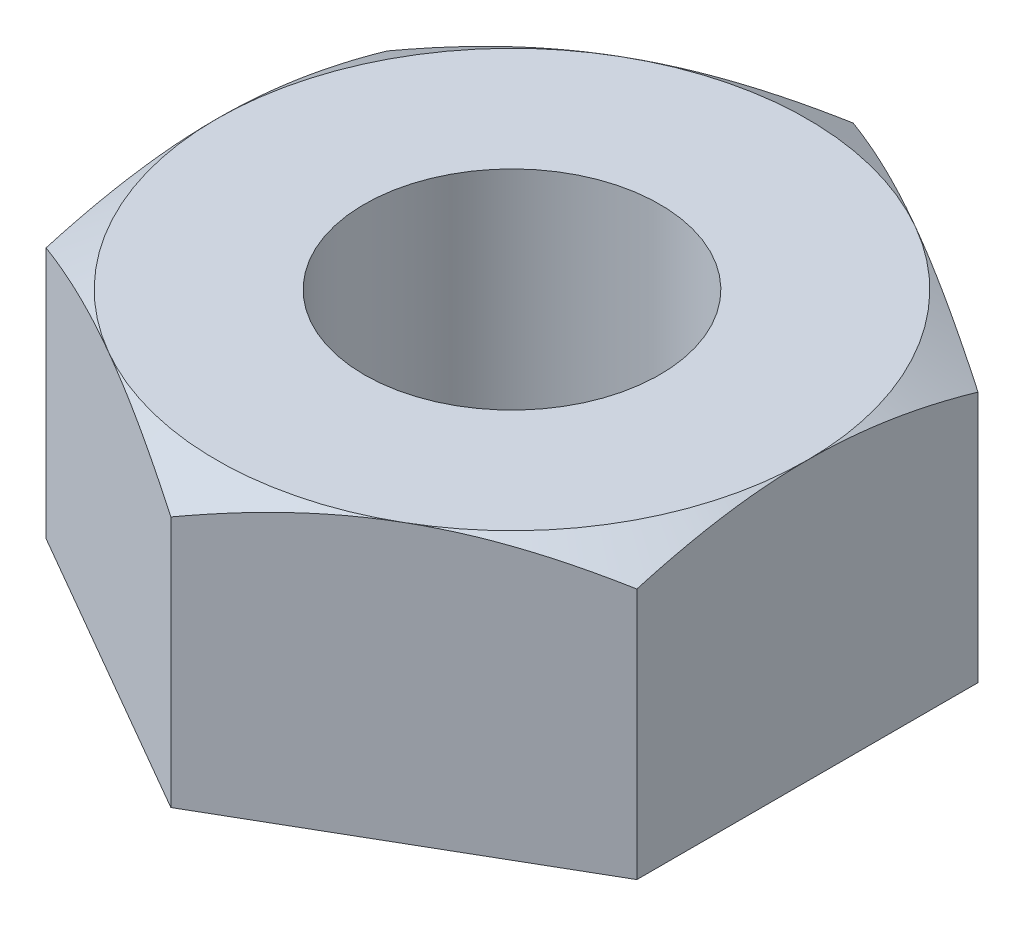
from build123d import *

# Parameters (mm, degrees)
BOSS_EXTRUDE1_DEPTH = 8
TAPPED_HOLE1_D      = 8.5


with BuildPart() as part:
    # Sketch1 → Boss-Extrude1 (new body)
    with BuildSketch(Plane(origin=(0, 0, 0), x_dir=(1, 0, 0), z_dir=(0, 1, 0))):
        Polygon((0, 9.814954576), (-8.5, 4.907477288), (-8.5, -4.907477288), (0, -9.814954576), (8.5, -4.907477288), (8.5, 4.907477288), align=None)
    extrude(amount=-BOSS_EXTRUDE1_DEPTH)

    # Sketch2 → Cut-Revolve1 (revolve, cut)
    with BuildSketch(Plane(origin=(0, 0, 0), x_dir=(0, 0, -1), z_dir=(1, 0, 0))):
        Polygon((8.5, 0), (9.814954576, 0), (9.814954576, -0.759189379), align=None)
    revolve(axis=Axis((0, 0, 0), (0, -1, 0)), mode=Mode.SUBTRACT)

    # Tapped Hole1 (through all)
    with Locations(Plane(origin=(0, 0, 0), x_dir=(1, 0, 0), z_dir=(0, 1, 0))):
        with Locations((0, 0)):
            Hole(TAPPED_HOLE1_D / 2)


solid = part.part
